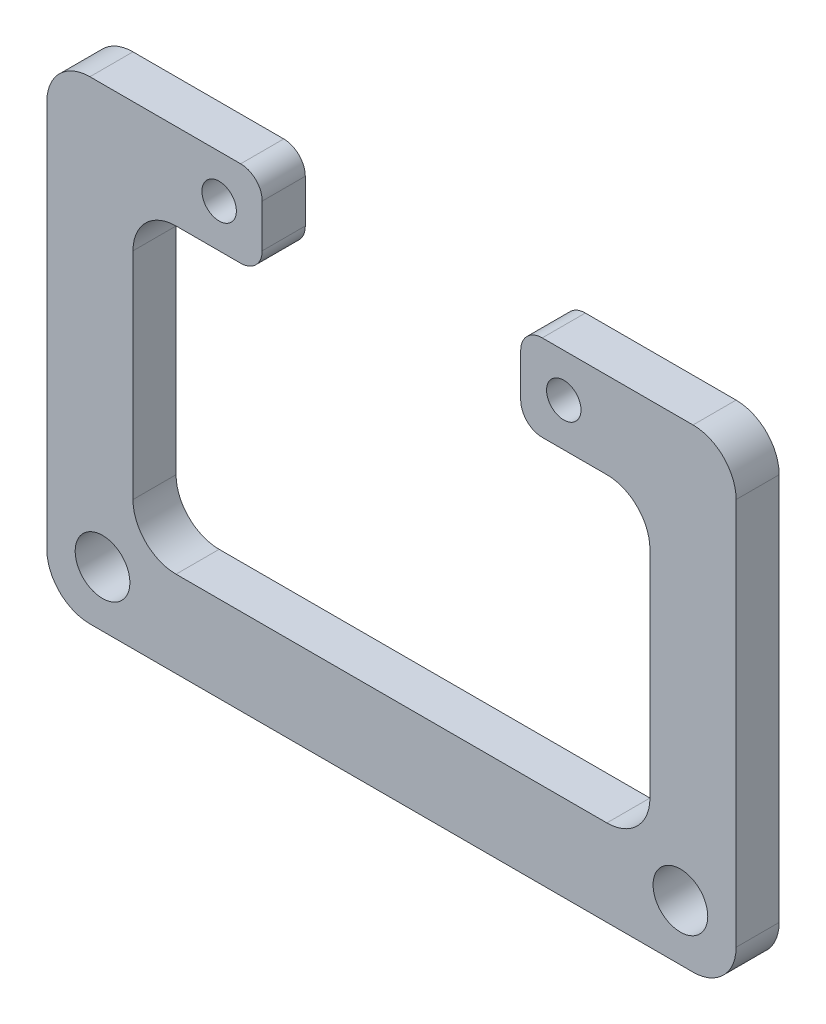
from build123d import *

# Parameters (mm, degrees)
SKETCH1_R           = 6.35
SKETCH1_R_2         = 4
BOSS_EXTRUDE1_DEPTH = 5
FILLET1_R           = 10
FILLET2_R           = 5


with BuildPart() as part:
    # Sketch1 → Boss-Extrude1 (new, symmetric)
    with BuildSketch(Plane.XY):
        with BuildLine():
            Line((0, 20), (0, 0))
            Line((0, 0), (70, 0))
            ThreePointArc((70, 0), (77.071067812, 2.928932188), (80, 10))
            Line((80, 10), (80, 110))
            Line((80, 110), (30, 110))
            Line((30, 110), (30, 90))
            Line((30, 90), (60, 90))
            Line((60, 90), (60, 30))
            ThreePointArc((60, 30), (57.071067812, 22.928932188), (50, 20))
            Line((50, 20), (0, 20))
        make_face()
        with Locations((67.071067812, 12.928932188)):
            Circle(SKETCH1_R, mode=Mode.SUBTRACT)
        with Locations((40, 100)):
            Circle(SKETCH1_R_2, mode=Mode.SUBTRACT)
    boss_extrude1 = extrude(amount=BOSS_EXTRUDE1_DEPTH, both=True)

    # Mirror1: Boss-Extrude1 across plane
    add(boss_extrude1.mirror(Plane(origin=(0, 0, -5), x_dir=(0, 0, 1), z_dir=(-1, 0, 0))))

    # Fillet1
    fillet1_edges = [part.edges().sort_by_distance(p)[0] for p in [
        (60, 90, 0),
        (80, 110, 0),
        (-80, 110, 0),
        (-60, 90, 0),
    ]]
    fillet(fillet1_edges, radius=FILLET1_R)

    # Fillet2
    fillet2_edges = [part.edges().sort_by_distance(p)[0] for p in [
        (30, 90, 0),
        (30, 110, 0),
        (-30, 110, 0),
        (-30, 90, 0),
    ]]
    fillet(fillet2_edges, radius=FILLET2_R)


solid = part.part
